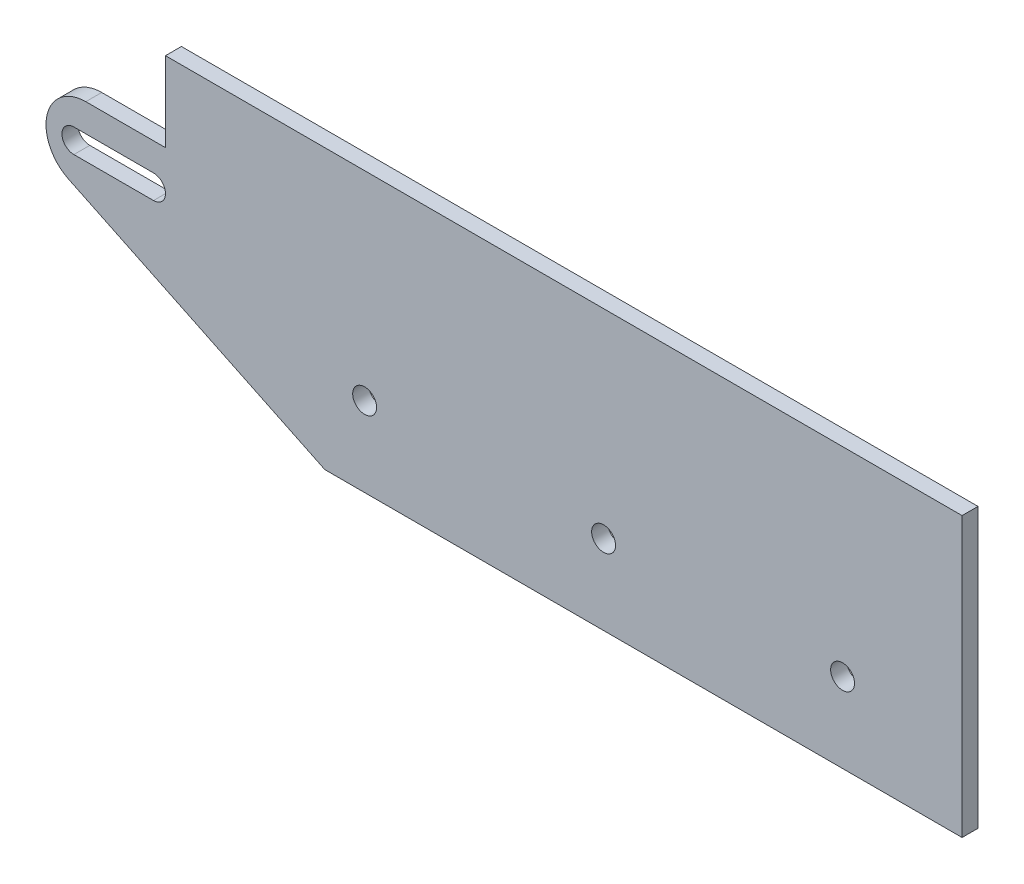
from build123d import *

# Parameters (mm, degrees)
AUFSATZ_LINEAR_AUSTRAGEN1_DEPTH = 2
SKIZZE2_R                       = 1.5
SCHNITT_LINEAR_AUSTRAGEN1_DEPTH = 68.344264789


with BuildPart() as part:
    # Skizze1 → Aufsatz-Linear austragen1 (new body)
    with BuildSketch(Plane.XY):
        Polygon((-50, 17.5), (-50, 7.5), (-50, -2.5), (-50, -7.866530531), (-30, -17.5), (50, -17.5), (50, 17.5), align=None)
        with BuildLine():
            Line((-50, -2.5), (-50, 7.5))
            Line((-50, 7.5), (-60, 7.5))
            ThreePointArc((-60, 7.5), (-56.464466094, 6.035533906), (-55, 2.5))
            ThreePointArc((-55, 2.5), (-56.464466094, -1.035533906), (-60, -2.5))
            Line((-60, -2.5), (-50, -2.5))
        make_face()
        with BuildLine():
            ThreePointArc((-55, 2.5), (-56.464466094, 6.035533906), (-60, 7.5))
            Line((-60, 7.5), (-60, -2.5))
            ThreePointArc((-60, -2.5), (-56.464466094, -1.035533906), (-55, 2.5))
        make_face()
        with BuildLine():
            Line((-60, -2.5), (-60, 7.5))
            ThreePointArc((-60, 7.5), (-64.874594918, 3.612800243), (-62.169780165, -2.004670247))
            ThreePointArc((-62.169780165, -2.004670247), (-61.112800243, -2.374594918), (-60, -2.5))
        make_face()
        with BuildLine():
            Line((-50, -7.866530531), (-50, -2.5))
            Line((-50, -2.5), (-60, -2.5))
            ThreePointArc((-60, -2.5), (-61.112800243, -2.374594918), (-62.169780165, -2.004670247))
            Line((-62.169780165, -2.004670247), (-50, -7.866530531))
        make_face()
    extrude(amount=AUFSATZ_LINEAR_AUSTRAGEN1_DEPTH)

    # Skizze2 → Schnitt-Linear austragen1 (cut, through all)
    with BuildSketch(Plane.XY.offset(2)):
        with Locations((-51.5, 2.5)):
            Circle(SKIZZE2_R)
        with BuildLine():
            Line((-51.5, 4), (-61.5, 4))
            ThreePointArc((-61.5, 4), (-60.439339828, 3.560660172), (-60, 2.5))
            ThreePointArc((-60, 2.5), (-60.439339828, 1.439339828), (-61.5, 1))
            Line((-61.5, 1), (-51.5, 1))
            ThreePointArc((-51.5, 1), (-53, 2.5), (-51.5, 4))
        make_face()
        with Locations((-61.5, 2.5)):
            Circle(SKIZZE2_R)
        with Locations((-25, -7.5)):
            Circle(SKIZZE2_R)
        with Locations((35, -7.5)):
            Circle(SKIZZE2_R)
        with Locations((5, -7.5)):
            Circle(SKIZZE2_R)
    extrude(amount=-SCHNITT_LINEAR_AUSTRAGEN1_DEPTH, mode=Mode.SUBTRACT)


solid = part.part
